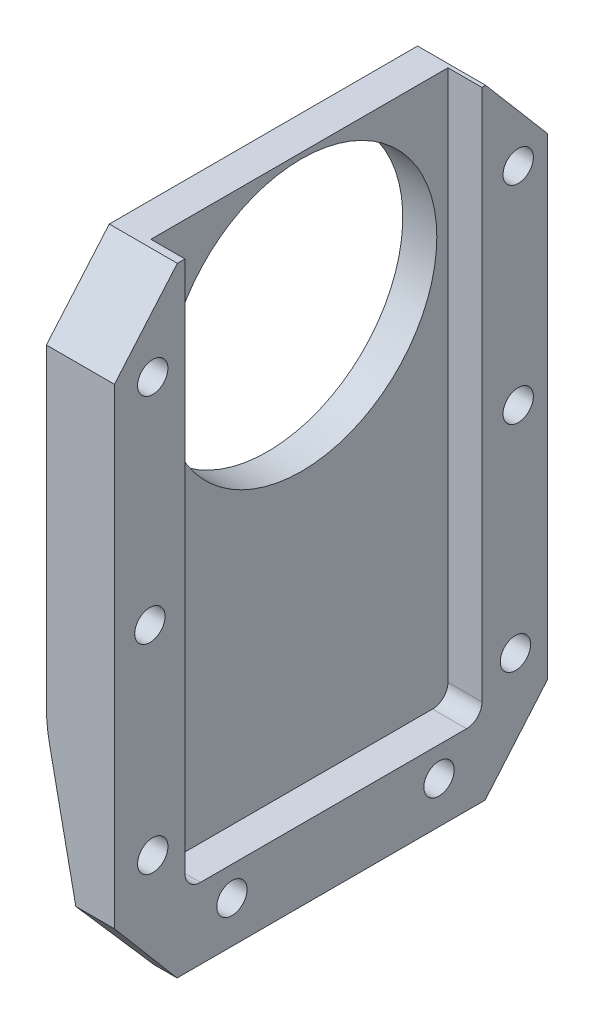
from build123d import *

# Parameters (mm, degrees)
BOSS_EXTRUDE1_DEPTH                   = 35.56
FILLET1_R                             = 12.7
F_7_8_0_875_DIAMETER_HOLE1_D          = 22.225
SKETCH6_W                             = 24.384
SKETCH6_H                             = 44.958
CUT_EXTRUDE1_DEPTH                    = 2.794
FILLET2_R                             = 1.27
F_40_0_098_DIAMETER_HOLE1_D           = 2.4892
F_40_0_098_DIAMETER_HOLE1_CSINK_D     = 3.7592
F_40_0_098_DIAMETER_HOLE1_CSINK_ANGLE = 90
CUT_EXTRUDE3_DEPTH                    = 63.260576162
CUT_EXTRUDE4_DEPTH                    = 63.260576162


with BuildPart() as part:
    # Sketch1 → Boss-Extrude1 (new body)
    with BuildSketch(Plane.XY):
        Polygon((0, 0), (0, 50.8), (-5.588, 50.8), (-5.588, 17.78), (-1.916643762, 0), align=None)
    extrude(amount=BOSS_EXTRUDE1_DEPTH)

    # Fillet1
    fillet1_edges = [part.edges().sort_by_distance(p)[0] for p in [
        (-5.588, 17.78, 17.78),
    ]]
    fillet(fillet1_edges, radius=FILLET1_R)

    # 7/8 (0.875) Diameter Hole1 (through all)
    with Locations(Plane.ZY.offset(5.588)):
        with Locations((17.415519888, 39.229457165)):
            Hole(F_7_8_0_875_DIAMETER_HOLE1_D / 2)

    # Sketch6 → Cut-Extrude1 (cut)
    with BuildSketch(Plane(origin=(0, 0, 0), x_dir=(0, 0, -1), z_dir=(1, 0, 0))):
        with Locations((-17.580042727, 28.321)):
            Rectangle(SKETCH6_W, SKETCH6_H)
    extrude(amount=-CUT_EXTRUDE1_DEPTH, mode=Mode.SUBTRACT)

    # Fillet2
    fillet2_edges = [part.edges().sort_by_distance(p)[0] for p in [
        (-1.397, 5.842, 29.772042727),
        (-1.397, 5.842, 5.388042727),
    ]]
    fillet(fillet2_edges, radius=FILLET2_R)

    # #40 (0.098) Diameter Hole1 (through all)
    with Locations(Plane.ZY.offset(5.588)):
        with Locations((32.415519888, 43.729457165), (32.652313364, 26.212120957), (32.415519888, 9.729457165), (25.915519888, 3.429457165), (8.915519888, 3.429457165), (2.642788208, 9.215688736), (2.415519888, 26.729457165), (2.415519888, 43.729457165)):
            CounterSinkHole(F_40_0_098_DIAMETER_HOLE1_D / 2, F_40_0_098_DIAMETER_HOLE1_CSINK_D / 2, counter_sink_angle=F_40_0_098_DIAMETER_HOLE1_CSINK_ANGLE)

    # Sketch10 → Cut-Extrude3 (cut, through all)
    with BuildSketch(Plane(origin=(0, 0, 0), x_dir=(0, 0, -1), z_dir=(1, 0, 0))):
        Polygon((-35.56, 44.780420684), (-30.397580851, 50.8), (-35.56, 50.8), align=None)
    extrude(amount=-CUT_EXTRUDE3_DEPTH, mode=Mode.SUBTRACT)

    # Sketch11 → Cut-Extrude4 (cut, through all)
    with BuildSketch(Plane(origin=(0, 0, 0), x_dir=(0, 0, -1), z_dir=(1, 0, 0))):
        Polygon((-5.085545117, 50.8), (0, 50.8), (0, 44.824895363), align=None)
        Polygon((0, 6.029531172), (-5.128692816, 0), (0, 0), align=None)
        Polygon((-35.56, 6.07121688), (-35.56, 0), (-30.417091858, 0), align=None)
    extrude(amount=-CUT_EXTRUDE4_DEPTH, mode=Mode.SUBTRACT)


solid = part.part
